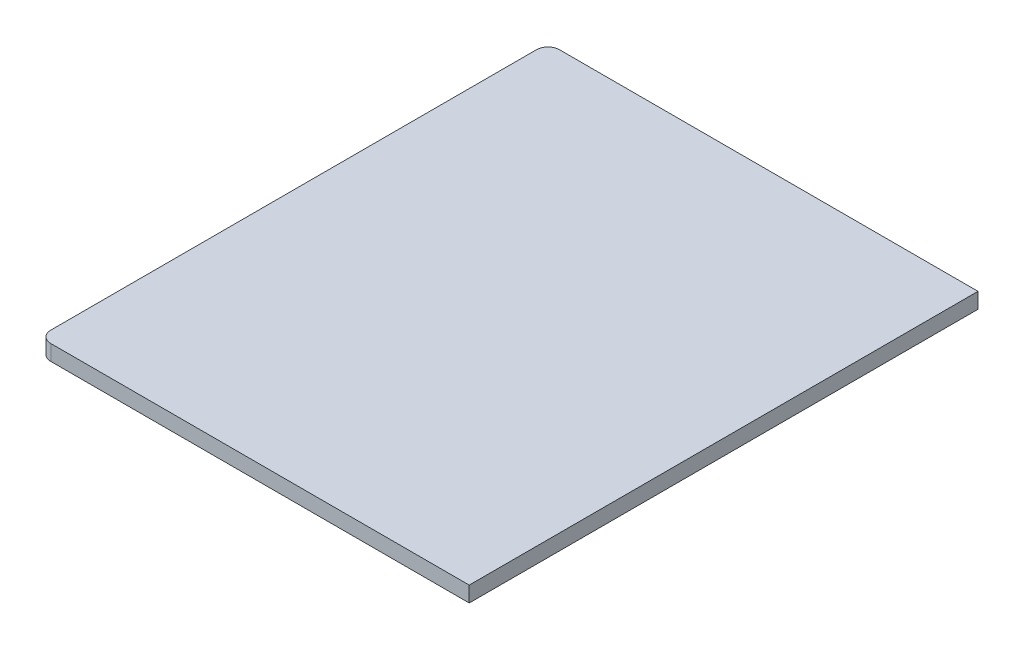
from build123d import *

# Parameters (mm, degrees)
BOSS_EXTRUDE1_DEPTH = 3.9
SKETCH1_6_R         = 2.1
CUT_EXTRUDE1_DEPTH  = 1.6


with BuildPart() as part:
    # Sketch1 → Boss-Extrude1 (new body)
    with BuildSketch(Plane(origin=(0, 0, 0), x_dir=(1, 0, 0), z_dir=(0, 1, 0))):
        with BuildLine():
            Line((-105.9, 60.929794432), (-105.9, -60.929794385))
            ThreePointArc((-105.9, -60.929794385), (-105.050609665, -62.980404051), (-103, -63.829794385))
            Line((-103, -63.829794385), (2, -63.829794385))
            Line((2, -63.829794385), (2, 63.829794385))
            Line((2, 63.829794385), (-103, 63.829794385))
            ThreePointArc((-103, 63.829794385), (-105.050609649, 62.980404067), (-105.9, 60.929794432))
        make_face()
    extrude(amount=BOSS_EXTRUDE1_DEPTH)

    # Sketch1<6> → Cut-Extrude1 (cut)
    with BuildSketch(Plane(origin=(0, 0, 0), x_dir=(1, 0, 0), z_dir=(0, 1, 0))):
        with Locations((-103, 60.929794385)):
            Circle(SKETCH1_6_R)
        with Locations((-5, 60.929794385)):
            Circle(SKETCH1_6_R)
        with Locations((-5, -60.929794385)):
            Circle(SKETCH1_6_R)
        with Locations((-103, -60.929794385)):
            Circle(SKETCH1_6_R)
    extrude(amount=CUT_EXTRUDE1_DEPTH, mode=Mode.SUBTRACT)


solid = part.part
